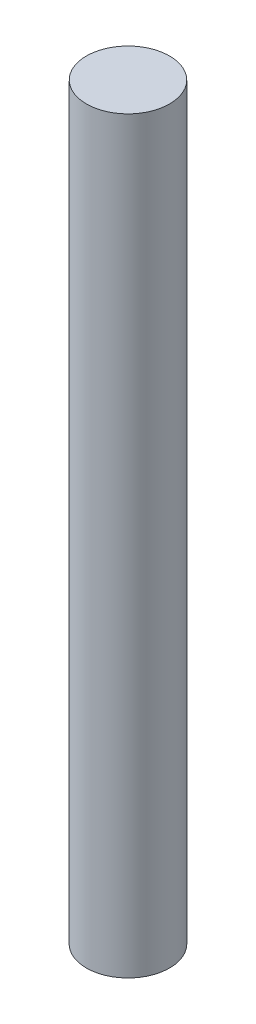
from build123d import *

# Parameters (mm, degrees)
SKETCH_1_R      = 30
EXTRUDE_1_DEPTH = 540


with BuildPart() as part:
    # 草图1 → 凸台-拉伸1 (new body)
    with BuildSketch(Plane(origin=(0, 0, 0), x_dir=(1, 0, 0), z_dir=(0, 1, 0))):
        with Locations(Location((0, 0, 0), (0, 0, 270))):
            Circle(SKETCH_1_R)
    extrude(amount=EXTRUDE_1_DEPTH)


solid = part.part
